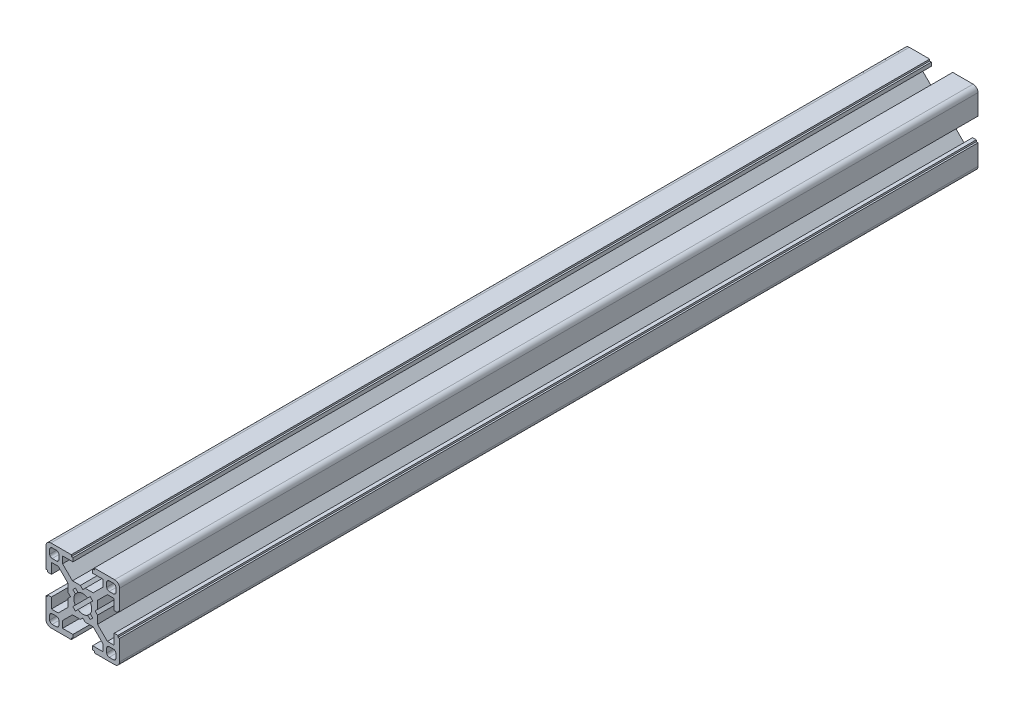
from build123d import *

# Parameters (mm, degrees)
ESTRUSIONE_ESTRUSIONE2_DEPTH = 350


with BuildPart() as part:
    # Schizzo1 → Estrusione-Estrusione2 (new body)
    with BuildSketch(Plane.XY):
        with BuildLine():
            Line((-15, 13), (-15, 4.7))
            Line((-15, 4.7), (-14.3, 4.7))
            Line((-14.3, 4.7), (-14.3, 4))
            Line((-14.3, 4), (-12.8, 4))
            Line((-12.8, 4), (-12.8, 8.25))
            Line((-12.8, 8.25), (-10.017766953, 8.25))
            Line((-10.017766953, 8.25), (-6, 4.232233047))
            Line((-6, 4.232233047), (-6, 1))
            Line((-6, 1), (-5, 0))
            Line((-5, 0), (-6, -1))
            Line((-6, -1), (-6, -4.232233047))
            Line((-6, -4.232233047), (-10.017766953, -8.25))
            Line((-10.017766953, -8.25), (-12.8, -8.25))
            Line((-12.8, -8.25), (-12.8, -4))
            Line((-12.8, -4), (-14.3, -4))
            Line((-14.3, -4), (-14.3, -4.7))
            Line((-14.3, -4.7), (-15, -4.7))
            Line((-15, -4.7), (-15, -13))
            ThreePointArc((-15, -13), (-14.414213562, -14.414213562), (-13, -15))
            Line((-13, -15), (-4.7, -15))
            Line((-4.7, -15), (-4.7, -14.3))
            Line((-4.7, -14.3), (-4, -14.3))
            Line((-4, -14.3), (-4, -12.8))
            Line((-4, -12.8), (-8.25, -12.8))
            Line((-8.25, -12.8), (-8.25, -10.017766953))
            Line((-8.25, -10.017766953), (-4.232233047, -6))
            Line((-4.232233047, -6), (-1, -6))
            Line((-1, -6), (0, -5))
            Line((0, -5), (1, -6))
            Line((1, -6), (4.232233047, -6))
            Line((4.232233047, -6), (8.25, -10.017766953))
            Line((8.25, -10.017766953), (8.25, -12.8))
            Line((8.25, -12.8), (4, -12.8))
            Line((4, -12.8), (4, -14.3))
            Line((4, -14.3), (4.7, -14.3))
            Line((4.7, -14.3), (4.7, -15))
            Line((4.7, -15), (13, -15))
            ThreePointArc((13, -15), (14.414213562, -14.414213562), (15, -13))
            Line((15, -13), (15, -4.7))
            Line((15, -4.7), (14.3, -4.7))
            Line((14.3, -4.7), (14.3, -4))
            Line((14.3, -4), (12.8, -4))
            Line((12.8, -4), (12.8, -8.25))
            Line((12.8, -8.25), (10.017766953, -8.25))
            Line((10.017766953, -8.25), (6, -4.232233047))
            Line((6, -4.232233047), (6, -1))
            Line((6, -1), (5, 0))
            Line((5, 0), (6, 1))
            Line((6, 1), (6, 4.232233047))
            Line((6, 4.232233047), (10.017766953, 8.25))
            Line((10.017766953, 8.25), (12.8, 8.25))
            Line((12.8, 8.25), (12.8, 4))
            Line((12.8, 4), (14.3, 4))
            Line((14.3, 4), (14.3, 4.7))
            Line((14.3, 4.7), (15, 4.7))
            Line((15, 4.7), (15, 13))
            ThreePointArc((15, 13), (14.414213562, 14.414213562), (13, 15))
            Line((13, 15), (4.7, 15))
            Line((4.7, 15), (4.7, 14.3))
            Line((4.7, 14.3), (4, 14.3))
            Line((4, 14.3), (4, 12.8))
            Line((4, 12.8), (8.25, 12.8))
            Line((8.25, 12.8), (8.25, 10.017766953))
            Line((8.25, 10.017766953), (4.232233047, 6))
            Line((4.232233047, 6), (1, 6))
            Line((1, 6), (0, 5))
            Line((0, 5), (-1, 6))
            Line((-1, 6), (-4.232233047, 6))
            Line((-4.232233047, 6), (-8.25, 10.017766953))
            Line((-8.25, 10.017766953), (-8.25, 12.8))
            Line((-8.25, 12.8), (-4, 12.8))
            Line((-4, 12.8), (-4, 14.3))
            Line((-4, 14.3), (-4.7, 14.3))
            Line((-4.7, 14.3), (-4.7, 15))
            Line((-4.7, 15), (-13, 15))
            ThreePointArc((-13, 15), (-14.414213562, 14.414213562), (-15, 13))
        make_face()
        with BuildLine():
            Line((13.5, 10.75), (13.5, 12.5))
            ThreePointArc((13.5, 12.5), (13.207106781, 13.207106781), (12.5, 13.5))
            Line((12.5, 13.5), (10.75, 13.5))
            ThreePointArc((10.75, 13.5), (10.042893219, 13.207106781), (9.75, 12.5))
            Line((9.75, 12.5), (9.75, 10.75))
            ThreePointArc((9.75, 10.75), (10.042893219, 10.042893219), (10.75, 9.75))
            Line((10.75, 9.75), (12.5, 9.75))
            ThreePointArc((12.5, 9.75), (13.207106781, 10.042893219), (13.5, 10.75))
        make_face(mode=Mode.SUBTRACT)
        with BuildLine():
            Line((10.75, -13.5), (12.5, -13.5))
            ThreePointArc((12.5, -13.5), (13.207106781, -13.207106781), (13.5, -12.5))
            Line((13.5, -12.5), (13.5, -10.75))
            ThreePointArc((13.5, -10.75), (13.207106781, -10.042893219), (12.5, -9.75))
            Line((12.5, -9.75), (10.75, -9.75))
            ThreePointArc((10.75, -9.75), (10.042893219, -10.042893219), (9.75, -10.75))
            Line((9.75, -10.75), (9.75, -12.5))
            ThreePointArc((9.75, -12.5), (10.042893219, -13.207106781), (10.75, -13.5))
        make_face(mode=Mode.SUBTRACT)
        with BuildLine():
            Line((-13.5, -10.75), (-13.5, -12.5))
            ThreePointArc((-13.5, -12.5), (-13.207106781, -13.207106781), (-12.5, -13.5))
            Line((-12.5, -13.5), (-10.75, -13.5))
            ThreePointArc((-10.75, -13.5), (-10.042893219, -13.207106781), (-9.75, -12.5))
            Line((-9.75, -12.5), (-9.75, -10.75))
            ThreePointArc((-9.75, -10.75), (-10.042893219, -10.042893219), (-10.75, -9.75))
            Line((-10.75, -9.75), (-12.5, -9.75))
            ThreePointArc((-12.5, -9.75), (-13.207106781, -10.042893219), (-13.5, -10.75))
        make_face(mode=Mode.SUBTRACT)
        with BuildLine():
            Line((1.995536102, 3.056196274), (3.00520382, 4.065863992))
            Line((3.00520382, 4.065863992), (4.065863992, 3.00520382))
            Line((4.065863992, 3.00520382), (3.056196274, 1.995536102))
            ThreePointArc((3.056196274, 1.995536102), (3.498400806, 1.041005187), (3.65, 0))
            ThreePointArc((3.65, 0), (3.498400806, -1.041005187), (3.056196274, -1.995536102))
            Line((3.056196274, -1.995536102), (4.065863992, -3.00520382))
            Line((4.065863992, -3.00520382), (3.00520382, -4.065863992))
            Line((3.00520382, -4.065863992), (1.995536102, -3.056196274))
            ThreePointArc((1.995536102, -3.056196274), (1.041005187, -3.498400806), (0, -3.65))
            ThreePointArc((0, -3.65), (-1.041005187, -3.498400806), (-1.995536102, -3.056196274))
            Line((-1.995536102, -3.056196274), (-3.00520382, -4.065863992))
            Line((-3.00520382, -4.065863992), (-4.065863992, -3.00520382))
            Line((-4.065863992, -3.00520382), (-3.056196274, -1.995536102))
            ThreePointArc((-3.056196274, -1.995536102), (-3.498400806, -1.041005187), (-3.65, 0))
            ThreePointArc((-3.65, 0), (-3.498400806, 1.041005187), (-3.056196274, 1.995536102))
            Line((-3.056196274, 1.995536102), (-4.065863992, 3.00520382))
            Line((-4.065863992, 3.00520382), (-3.00520382, 4.065863992))
            Line((-3.00520382, 4.065863992), (-1.995536102, 3.056196274))
            ThreePointArc((-1.995536102, 3.056196274), (-1.041005187, 3.498400806), (0, 3.65))
            ThreePointArc((0, 3.65), (1.041005187, 3.498400806), (1.995536102, 3.056196274))
        make_face(mode=Mode.SUBTRACT)
        with BuildLine():
            Line((-10.75, 9.75), (-12.5, 9.75))
            ThreePointArc((-12.5, 9.75), (-13.207106781, 10.042893219), (-13.5, 10.75))
            Line((-13.5, 10.75), (-13.5, 12.5))
            ThreePointArc((-13.5, 12.5), (-13.207106781, 13.207106781), (-12.5, 13.5))
            Line((-12.5, 13.5), (-10.75, 13.5))
            ThreePointArc((-10.75, 13.5), (-10.042893219, 13.207106781), (-9.75, 12.5))
            Line((-9.75, 12.5), (-9.75, 10.75))
            ThreePointArc((-9.75, 10.75), (-10.042893219, 10.042893219), (-10.75, 9.75))
        make_face(mode=Mode.SUBTRACT)
    extrude(amount=ESTRUSIONE_ESTRUSIONE2_DEPTH)


solid = part.part
